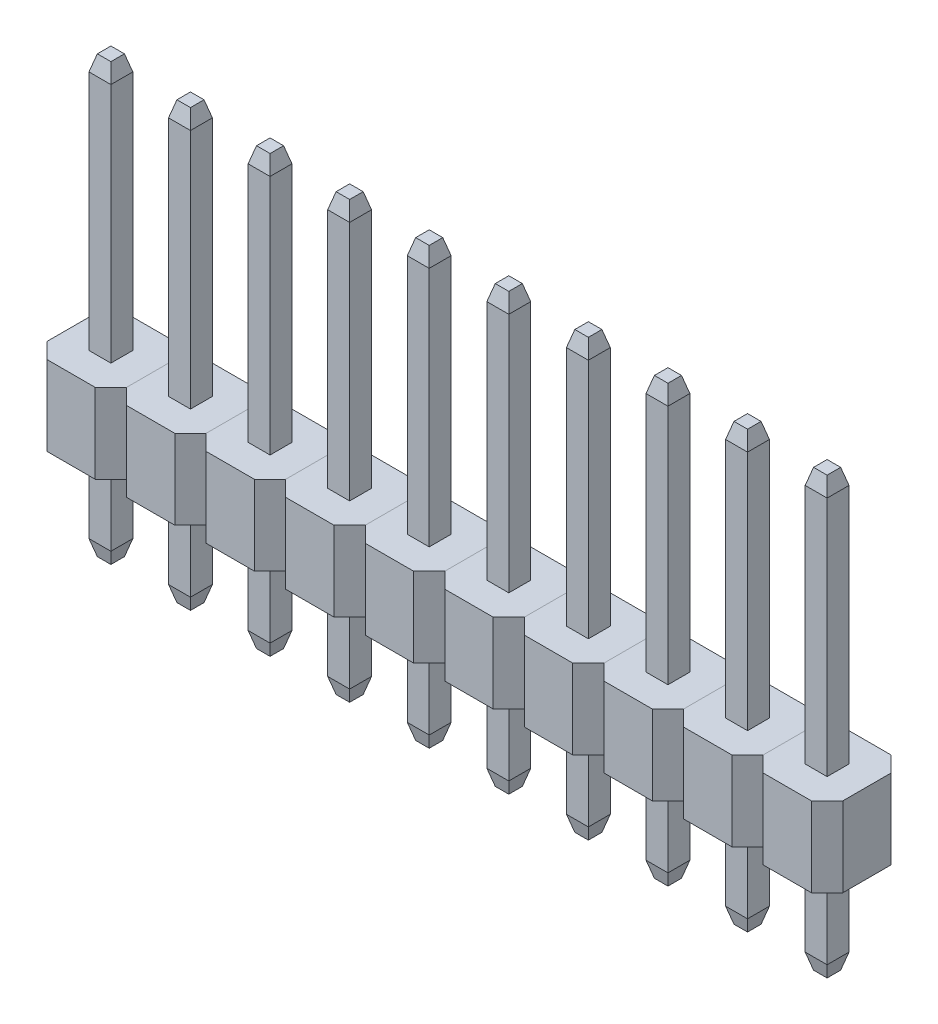
from build123d import *

# Parameters (mm, degrees)
SKETCH3_W           = 2.54
SKETCH3_H           = 2.54
SKETCH3_W_2         = 0.635
SKETCH3_H_2         = 0.635
BOSS_EXTRUDE1_DEPTH = 1.27
CHAMFER1_SIZE       = 0.5
BOSS_EXTRUDE2_START = -5.2
SKETCH5_W           = 0.7
SKETCH5_H           = 0.7
BOSS_EXTRUDE2_DEPTH = 12.9
SKETCH6_W           = 0.7
SKETCH6_H           = 0.7
BOSS_EXTRUDE3_DEPTH = 0.5
BOSS_EXTRUDE3_TAPER = 15
SKETCH7_W           = 0.7
SKETCH7_H           = 0.7
BOSS_EXTRUDE4_DEPTH = 0.5
BOSS_EXTRUDE4_TAPER = 15
LPATTERN1_COUNT     = 10
LPATTERN1_PITCH     = 2.54


with BuildPart() as part:
    # Sketch3 → Boss-Extrude1 (new, symmetric)
    with BuildSketch(Plane(origin=(0, 0, 0), x_dir=(1, 0, 0), z_dir=(0, 1, 0))):
        Rectangle(SKETCH3_W, SKETCH3_H)
        Rectangle(SKETCH3_W_2, SKETCH3_H_2, mode=Mode.SUBTRACT)
    extrude(amount=BOSS_EXTRUDE1_DEPTH, both=True)

    # Chamfer1
    chamfer1_edges = [part.edges().sort_by_distance(p)[0] for p in [
        (1.27, 0, 1.27),
        (-1.27, 0, 1.27),
        (-1.27, 0, -1.27),
        (1.27, 0, -1.27),
    ]]
    chamfer(chamfer1_edges, length=CHAMFER1_SIZE)


with BuildPart() as body_2:
    # Sketch5 → Boss-Extrude2 (new body)
    with BuildSketch(Plane(origin=(0, 1.27, 0), x_dir=(1, 0, 0), z_dir=(0, 1, 0)).offset(BOSS_EXTRUDE2_START)):
        Rectangle(SKETCH5_W, SKETCH5_H)
    extrude(amount=BOSS_EXTRUDE2_DEPTH)

    # Sketch6 → Boss-Extrude3 (add)
    with BuildSketch(Plane(origin=(0, 8.97, 0), x_dir=(1, 0, 0), z_dir=(0, 1, 0))):
        Rectangle(SKETCH6_W, SKETCH6_H)
    extrude(amount=BOSS_EXTRUDE3_DEPTH, taper=BOSS_EXTRUDE3_TAPER)

    # Sketch7 → Boss-Extrude4 (add)
    with BuildSketch(Plane.XZ.offset(3.93)):
        Rectangle(SKETCH7_W, SKETCH7_H)
    extrude(amount=BOSS_EXTRUDE4_DEPTH, taper=BOSS_EXTRUDE4_TAPER)


with BuildPart() as lpattern1_1:
    # LPattern1: pattern copy
    add(body_2.part.moved(Location(Vector(1, 0, 0) * (1 * LPATTERN1_PITCH))))


with BuildPart() as lpattern1_2:
    # LPattern1: pattern copy
    add(body_2.part.moved(Location(Vector(1, 0, 0) * (2 * LPATTERN1_PITCH))))


with BuildPart() as lpattern1_3:
    # LPattern1: pattern copy
    add(body_2.part.moved(Location(Vector(1, 0, 0) * (3 * LPATTERN1_PITCH))))


with BuildPart() as lpattern1_4:
    # LPattern1: pattern copy
    add(body_2.part.moved(Location(Vector(1, 0, 0) * (4 * LPATTERN1_PITCH))))


with BuildPart() as lpattern1_5:
    # LPattern1: pattern copy
    add(body_2.part.moved(Location(Vector(1, 0, 0) * (5 * LPATTERN1_PITCH))))


with BuildPart() as lpattern1_6:
    # LPattern1: pattern copy
    add(body_2.part.moved(Location(Vector(1, 0, 0) * (6 * LPATTERN1_PITCH))))


with BuildPart() as lpattern1_7:
    # LPattern1: pattern copy
    add(body_2.part.moved(Location(Vector(1, 0, 0) * (7 * LPATTERN1_PITCH))))


with BuildPart() as lpattern1_8:
    # LPattern1: pattern copy
    add(body_2.part.moved(Location(Vector(1, 0, 0) * (8 * LPATTERN1_PITCH))))


with BuildPart() as lpattern1_9:
    # LPattern1: pattern copy
    add(body_2.part.moved(Location(Vector(1, 0, 0) * (9 * LPATTERN1_PITCH))))


with BuildPart() as lpattern1_10:
    # LPattern1: pattern copy
    add(part.part.moved(Location(Vector(1, 0, 0) * (1 * LPATTERN1_PITCH))))


with BuildPart() as lpattern1_11:
    # LPattern1: pattern copy
    add(part.part.moved(Location(Vector(1, 0, 0) * (2 * LPATTERN1_PITCH))))


with BuildPart() as lpattern1_12:
    # LPattern1: pattern copy
    add(part.part.moved(Location(Vector(1, 0, 0) * (3 * LPATTERN1_PITCH))))


with BuildPart() as lpattern1_13:
    # LPattern1: pattern copy
    add(part.part.moved(Location(Vector(1, 0, 0) * (4 * LPATTERN1_PITCH))))


with BuildPart() as lpattern1_14:
    # LPattern1: pattern copy
    add(part.part.moved(Location(Vector(1, 0, 0) * (5 * LPATTERN1_PITCH))))


with BuildPart() as lpattern1_15:
    # LPattern1: pattern copy
    add(part.part.moved(Location(Vector(1, 0, 0) * (6 * LPATTERN1_PITCH))))


with BuildPart() as lpattern1_16:
    # LPattern1: pattern copy
    add(part.part.moved(Location(Vector(1, 0, 0) * (7 * LPATTERN1_PITCH))))


with BuildPart() as lpattern1_17:
    # LPattern1: pattern copy
    add(part.part.moved(Location(Vector(1, 0, 0) * (8 * LPATTERN1_PITCH))))


with BuildPart() as lpattern1_18:
    # LPattern1: pattern copy
    add(part.part.moved(Location(Vector(1, 0, 0) * (9 * LPATTERN1_PITCH))))


solid = Compound([part.part, body_2.part, lpattern1_1.part, lpattern1_2.part, lpattern1_3.part, lpattern1_4.part, lpattern1_5.part, lpattern1_6.part, lpattern1_7.part, lpattern1_8.part, lpattern1_9.part, lpattern1_10.part, lpattern1_11.part, lpattern1_12.part, lpattern1_13.part, lpattern1_14.part, lpattern1_15.part, lpattern1_16.part, lpattern1_17.part, lpattern1_18.part])
